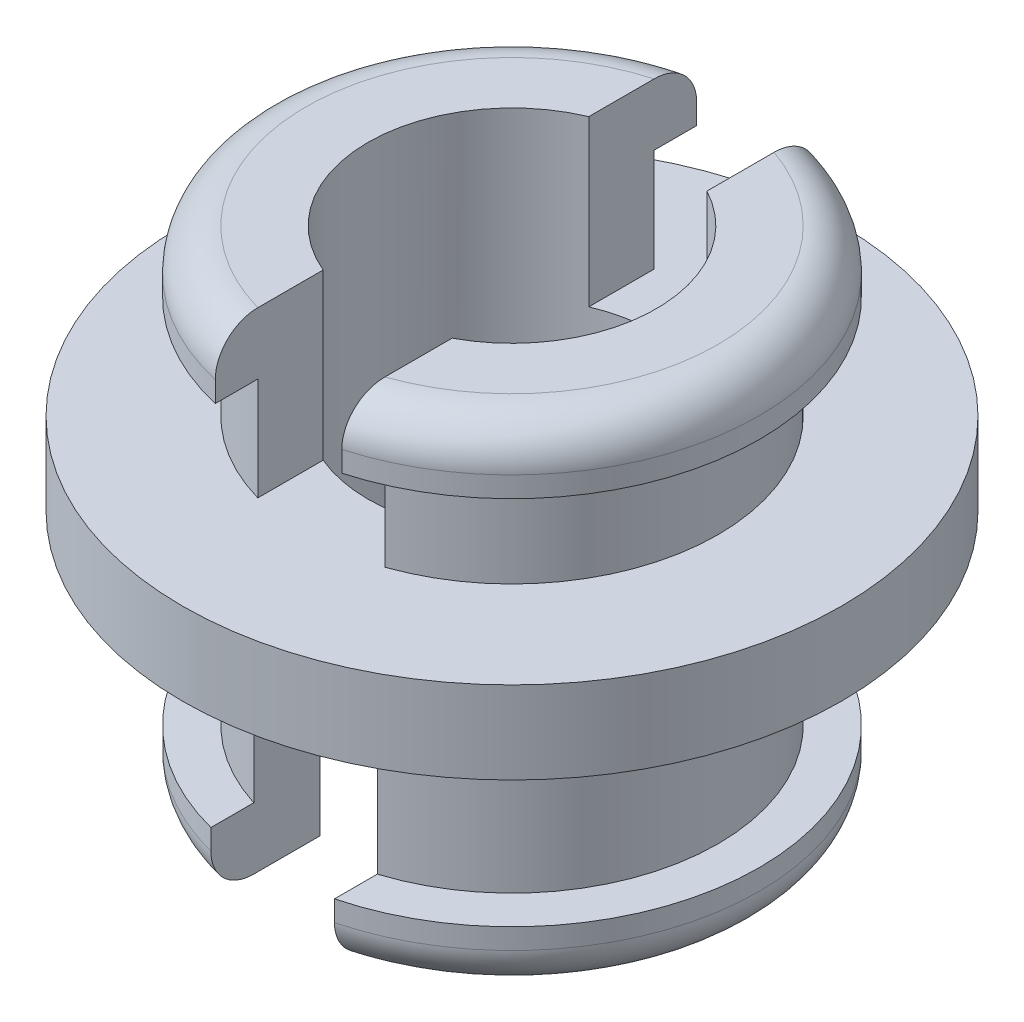
from build123d import *

# Parameters (mm, degrees)
ESQUISSE2_W             = 3
ESQUISSE2_H             = 13.00905209
ENL_V_MAT_EXTRU_1_DEPTH = 4
ESQUISSE3_W             = 3
ESQUISSE3_H             = 13.12821898
ENL_V_MAT_EXTRU_2_DEPTH = 6


with BuildPart() as part:
    # Esquisse1 → Révolution2 (revolve)
    with BuildSketch(Plane.XY, mode=Mode.PRIVATE) as r_volution2_sk:
        with BuildLine():
            Line((-5, 1.5), (-5, 6))
            Line((-5, 6), (-8, 6))
            Line((-8, 6), (-8, 8))
            Line((-8, 8), (-5, 8))
            Line((-5, 8), (-5, 10.5))
            Line((-5, 10.5), (-6, 10.5))
            Line((-6, 10.5), (-6, 11))
            ThreePointArc((-6, 11), (-5.707106781, 11.707106781), (-5, 12))
            Line((-5, 12), (-3.5, 12))
            Line((-3.5, 12), (-3.5, 0))
            Line((-3.5, 0), (-5, 0))
            ThreePointArc((-5, 0), (-5.707106781, 0.292893219), (-6, 1))
            Line((-6, 1), (-6, 1.5))
            Line((-6, 1.5), (-5, 1.5))
        make_face()
    revolve(r_volution2_sk.sketch.rotate(Axis((0, 12, 0), (0, 1, 0)), 270), axis=Axis((0, 12, 0), (0, 1, 0)))

    # Esquisse2 → Enlèv. mat.-Extru.1 (cut)
    with BuildSketch(Plane(origin=(0, 12, 0), x_dir=(1, 0, 0), z_dir=(0, 1, 0))):
        with Locations((0.139511346, 0)):
            Rectangle(ESQUISSE2_W, ESQUISSE2_H)
    extrude(amount=-ENL_V_MAT_EXTRU_1_DEPTH, mode=Mode.SUBTRACT)

    # Esquisse3 → Enlèv. mat.-Extru.2 (cut)
    with BuildSketch(Plane.XZ):
        Rectangle(ESQUISSE3_W, ESQUISSE3_H)
    extrude(amount=-ENL_V_MAT_EXTRU_2_DEPTH, mode=Mode.SUBTRACT)


solid = part.part
